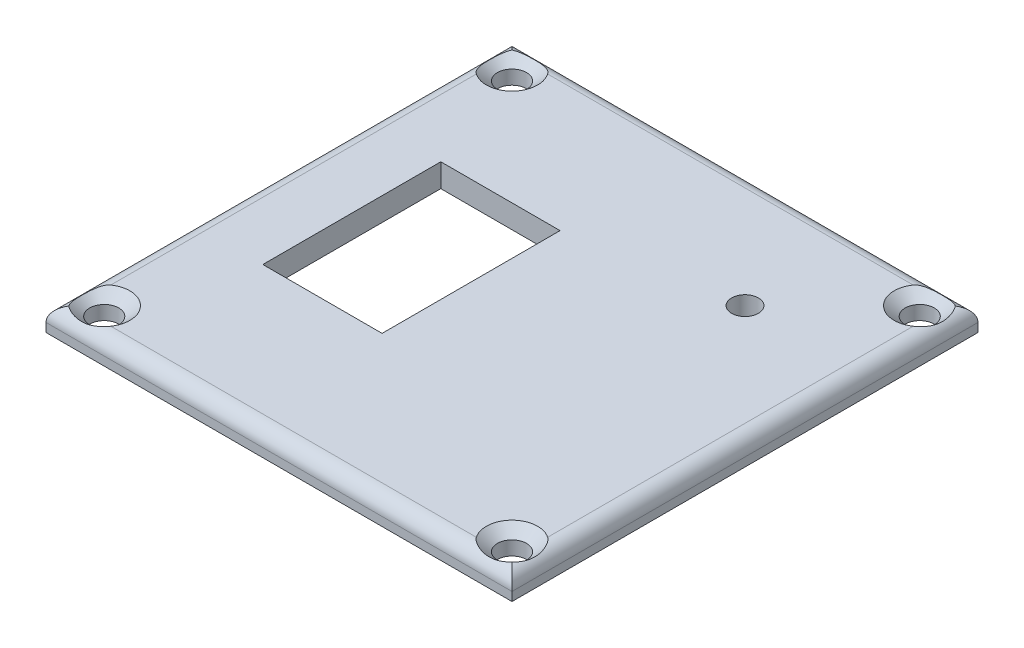
from build123d import *

# Parameters (mm, degrees)
SKETCH1_W                                       = 50.8
SKETCH1_H                                       = 50.8
BOSS_EXTRUDE1_DEPTH                             = 2.54
FILLET1_R                                       = 1.5875
CSK_FOR_M3_FLAT_HEAD_MACHINE_SCREW1_D           = 3.175
CSK_FOR_M3_FLAT_HEAD_MACHINE_SCREW1_CSINK_D     = 5.588
CSK_FOR_M3_FLAT_HEAD_MACHINE_SCREW1_CSINK_ANGLE = 100
SKETCH4_W                                       = 13
SKETCH4_H                                       = 19.4
CUT_EXTRUDE1_DEPTH                              = 72.886936368
SKETCH5_R                                       = 1.4605
CUT_EXTRUDE2_DEPTH                              = 72.886936368


with BuildPart() as part:
    # Sketch1 → Boss-Extrude1 (new body)
    with BuildSketch(Plane(origin=(0, 0, 0), x_dir=(1, 0, 0), z_dir=(0, 1, 0))):
        with Locations((25.4, 25.4)):
            Rectangle(SKETCH1_W, SKETCH1_H)
    extrude(amount=BOSS_EXTRUDE1_DEPTH)

    # Fillet1
    fillet1_edges = [part.edges().sort_by_distance(p)[0] for p in [
        (50.8, 2.54, -25.4),
        (25.4, 2.54, -50.8),
        (0, 2.54, -25.4),
        (25.4, 2.54, 0),
    ]]
    fillet(fillet1_edges, radius=FILLET1_R)

    # CSK for M3 Flat Head Machine Screw1 (through all)
    with Locations(Plane(origin=(0, 2.54, 0), x_dir=(1, 0, 0), z_dir=(0, 1, 0))):
        with Locations((3.175, 47.625), (47.625, 47.625), (47.625, 3.175), (3.175, 3.175)):
            CounterSinkHole(CSK_FOR_M3_FLAT_HEAD_MACHINE_SCREW1_D / 2, CSK_FOR_M3_FLAT_HEAD_MACHINE_SCREW1_CSINK_D / 2, counter_sink_angle=CSK_FOR_M3_FLAT_HEAD_MACHINE_SCREW1_CSINK_ANGLE)

    # Sketch4 → Cut-Extrude1 (cut, through all)
    with BuildSketch(Plane(origin=(0, 2.54, 0), x_dir=(1, 0, 0), z_dir=(0, 1, 0))):
        with Locations((14.4375, 25.4)):
            Rectangle(SKETCH4_W, SKETCH4_H)
    extrude(amount=-CUT_EXTRUDE1_DEPTH, mode=Mode.SUBTRACT)

    # Sketch5 → Cut-Extrude2 (cut, through all)
    with BuildSketch(Plane(origin=(0, 2.54, 0), x_dir=(1, 0, 0), z_dir=(0, 1, 0))):
        with Locations(Location((38.1, 38.1, 0), (0, 0, 270))):
            Circle(SKETCH5_R)
    extrude(amount=-CUT_EXTRUDE2_DEPTH, mode=Mode.SUBTRACT)


solid = part.part
